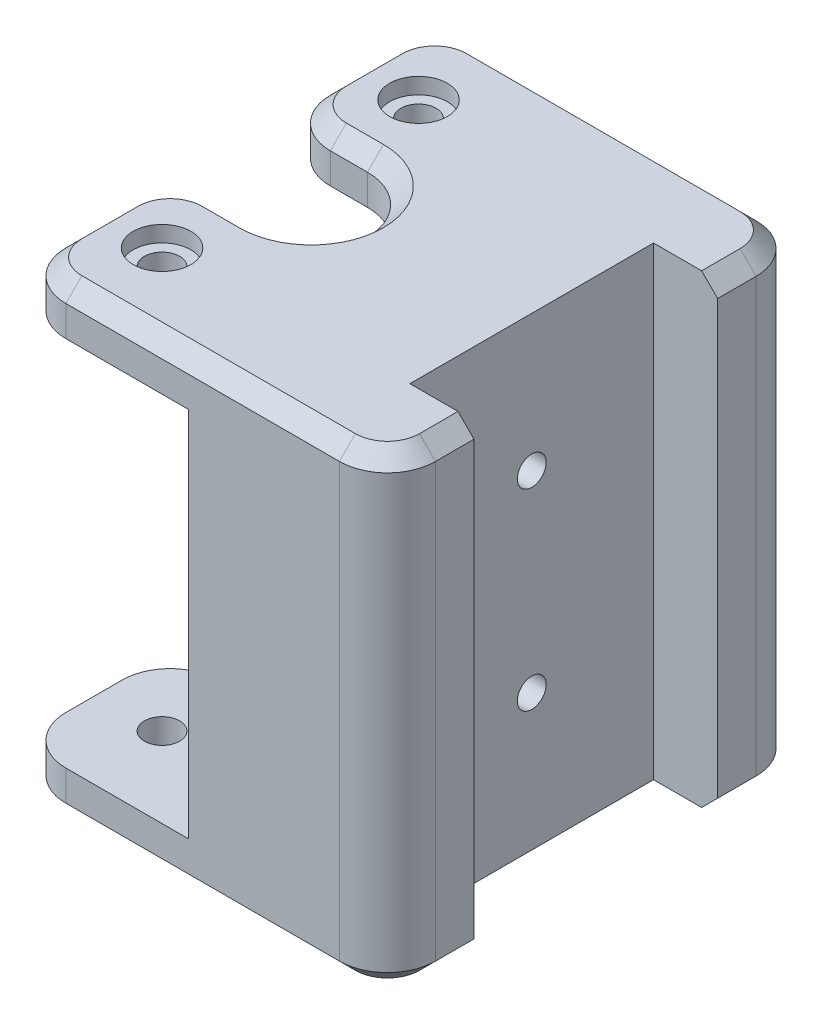
from build123d import *

# Parameters (mm, degrees)
SKETCH_2_W          = 23.064561435
SKETCH_2_H          = 26
SKETCH_2_R          = 1.1
EXTRUDE_1_DEPTH     = 14.5
SKETCH_3_R          = 33
CUT_EXTRUDE_1_DEPTH = 11.6
SKETCH_4_R          = 3.5
CUT_EXTRUDE_2_DEPTH = 54.268776032
SKETCH_5_W          = 15.2
SKETCH_5_H          = 29
CUT_EXTRUDE_3_DEPTH = 4
FILLET_1_R          = 3
SKETCH_6_R          = 0.9
CUT_EXTRUDE_4_DEPTH = 28.252660471
CHAMFER_1_SIZE      = 1
SKETCH_7_R          = 1.8
CUT_EXTRUDE_5_DEPTH = 1


with BuildPart() as part:
    # Эскиз2 → Бобышка-Вытянуть1 (new, symmetric)
    with BuildSketch(Plane(origin=(0, 0, 0), x_dir=(1, 0, 0), z_dir=(0, 1, 0))):
        with Locations((31.217719282, 0)):
            Rectangle(SKETCH_2_W, SKETCH_2_H)
        with Locations(Location((23.685438565, 8, 0), (0, 0, 90))):
            Circle(SKETCH_2_R, mode=Mode.SUBTRACT)
        with Locations(Location((23.685438565, -8, 0), (0, 0, 90))):
            Circle(SKETCH_2_R, mode=Mode.SUBTRACT)
    extrude(amount=EXTRUDE_1_DEPTH, both=True)

    # Эскиз3 → Вырез-Вытянуть1 (cut, symmetric)
    with BuildSketch(Plane(origin=(0, 0, 0), x_dir=(1, 0, 0), z_dir=(0, 1, 0))):
        Circle(SKETCH_3_R)
    extrude(amount=CUT_EXTRUDE_1_DEPTH, both=True, mode=Mode.SUBTRACT)

    # Эскиз4 → Вырез-Вытянуть2 (cut, through all)
    with BuildSketch(Plane(origin=(0, 14.5, 0), x_dir=(1, 0, 0), z_dir=(0, 1, 0))):
        with Locations((25, 0)):
            Circle(SKETCH_4_R)
        with BuildLine():
            ThreePointArc((25, -3.5), (21.5, 0), (25, 3.5))
            Line((25, 3.5), (19.685438565, 3.5))
            Line((19.685438565, 3.5), (19.685438565, -3.5))
            Line((19.685438565, -3.5), (25, -3.5))
        make_face()
    extrude(amount=-CUT_EXTRUDE_2_DEPTH, mode=Mode.SUBTRACT)

    # Эскиз5 → Вырез-Вытянуть3 (cut)
    with BuildSketch(Plane(origin=(42.75, 0, 0), x_dir=(0, 0, -1), z_dir=(1, 0, 0))):
        Rectangle(SKETCH_5_W, SKETCH_5_H)
    extrude(amount=-CUT_EXTRUDE_3_DEPTH, mode=Mode.SUBTRACT)

    # Скругление1
    fillet_1_edges = [part.edges().sort_by_distance(p)[0] for p in [
        (19.685438565, -13.05, 13),
        (19.685438565, -13.05, -13),
        (19.685438565, 13.05, 3.5),
        (19.685438565, 13.05, -3.5),
        (19.685438565, -13.05, 3.5),
        (19.685438565, -13.05, -3.5),
        (42.75, 0, 13),
        (19.685438565, 13.05, 13),
        (19.685438565, 13.05, -13),
        (42.75, 0, -13),
    ]]
    fillet(fillet_1_edges, radius=FILLET_1_R)

    # Эскиз6 → Вырез-Вытянуть4 (cut, through all)
    with BuildSketch(Plane(origin=(38.75, 0, 0), x_dir=(0, 0, -1), z_dir=(1, 0, 0))):
        with Locations((0, 6)):
            Circle(SKETCH_6_R)
        with Locations((0, -6)):
            Circle(SKETCH_6_R)
    extrude(amount=-CUT_EXTRUDE_4_DEPTH, mode=Mode.SUBTRACT)

    # Фаска1
    chamfer_1_edges = [part.edges().sort_by_distance(p)[0] for p in [
        (20.564118221, 14.5, 12.121320344),
        (20.564118221, 14.5, 4.378679656),
        (20.564118221, 14.5, -4.378679656),
        (20.564118221, 14.5, -12.121320344),
        (41.871320344, 14.5, -12.121320344),
        (28.5, -14.5, 0),
        (23.842719282, -14.5, -3.5),
        (28.5, 14.5, 0),
        (23.842719282, 14.5, -3.5),
        (42.75, -14.5, -8.8),
        (42.75, 14.5, -8.8),
        (31.217719282, 14.5, -13),
        (31.217719282, -14.5, -13),
        (42.75, -14.5, 8.8),
        (31.217719282, -14.5, 13),
        (19.685438565, -14.5, 8.25),
        (23.842719282, -14.5, 3.5),
        (19.685438565, -14.5, -8.25),
        (41.871320344, -14.5, 12.121320344),
        (20.564118221, -14.5, 12.121320344),
        (20.564118221, -14.5, 4.378679656),
        (20.564118221, -14.5, -4.378679656),
        (20.564118221, -14.5, -12.121320344),
        (41.871320344, -14.5, -12.121320344),
        (19.685438565, 14.5, -8.25),
        (23.842719282, 14.5, 3.5),
        (19.685438565, 14.5, 8.25),
        (31.217719282, 14.5, 13),
        (42.75, 14.5, 8.8),
        (41.871320344, 14.5, 12.121320344),
    ]]
    chamfer(chamfer_1_edges, length=CHAMFER_1_SIZE)

    # Эскиз7 → Вырез-Вытянуть5 (cut)
    with BuildSketch(Plane(origin=(0, 14.5, 0), x_dir=(1, 0, 0), z_dir=(0, 1, 0))):
        with Locations(Location((23.685438565, 8, 0), (0, 0, 270))):
            Circle(SKETCH_7_R)
        with Locations(Location((23.685438565, -8, 0), (0, 0, 270))):
            Circle(SKETCH_7_R)
    cut_extrude_5 = extrude(amount=-CUT_EXTRUDE_5_DEPTH, mode=Mode.SUBTRACT)

    # Зеркальное отражение1: Вырез-Вытянуть5 across plane
    add(cut_extrude_5.mirror(Plane.ZX), mode=Mode.SUBTRACT)


solid = part.part
